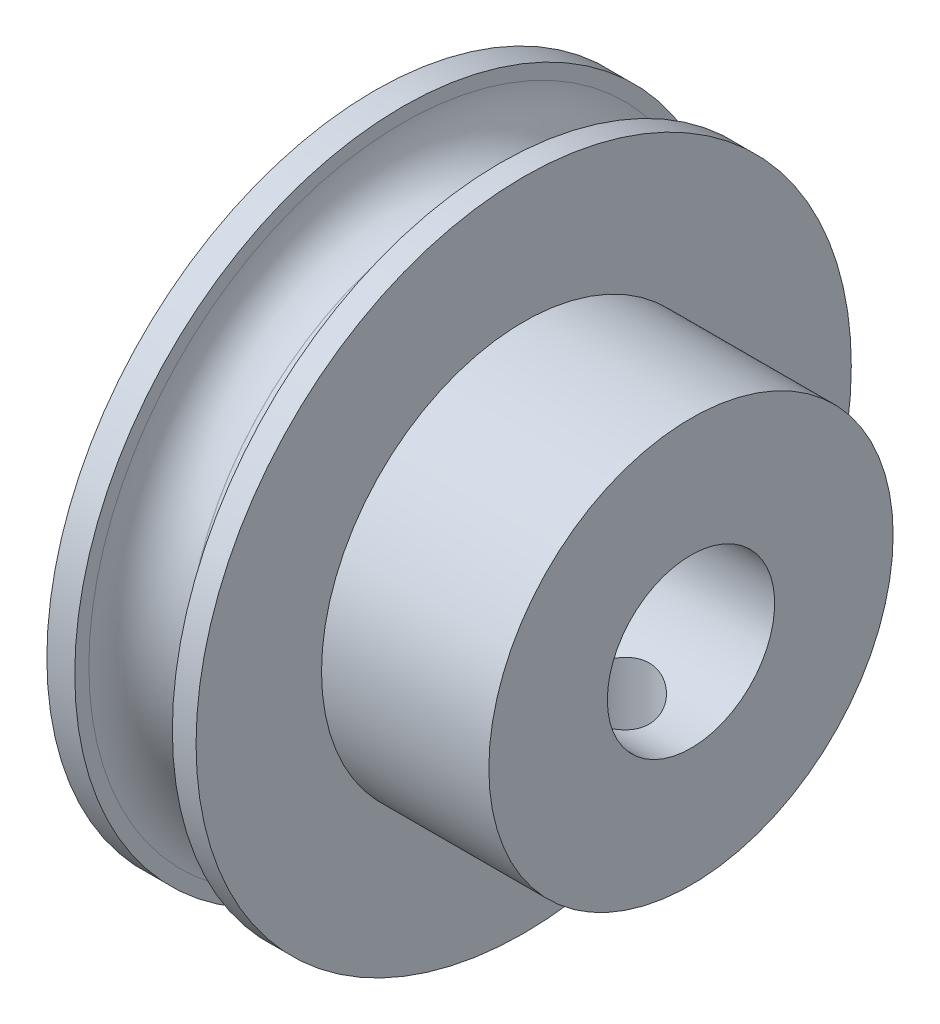
from build123d import *

# Parameters (mm, degrees)
CUT_EXTRUDE_1_REACH      = 42.247
CUT_EXTRUDE_1_END_RADIUS = 14.5
SKETCH_2_R               = 3


with BuildPart() as part:
    # Sketch 259 → Повернуть1 (revolve)
    with BuildSketch(Plane.XY, mode=Mode.PRIVATE) as revolve_1_sk:
        with BuildLine():
            Line((0, 6), (22.7, 6))
            Line((22.7, 6), (22.7, 14.5))
            Line((22.7, 14.5), (10.7, 14.5))
            Line((10.7, 14.5), (10.7, 23.5))
            Line((10.7, 23.5), (9, 23.5))
            Line((9, 23.5), (9, 22.49))
            ThreePointArc((9, 22.49), (7.977802666, 20.022197334), (5.51, 19))
            Line((5.51, 19), (5.49, 19))
            ThreePointArc((5.49, 19), (3.022197334, 20.022197334), (2, 22.49))
            Line((2, 22.49), (2, 23.5))
            Line((2, 23.5), (0, 23.5))
            Line((0, 23.5), (0, 6))
        make_face()
    revolve(revolve_1_sk.sketch.rotate(Axis((0, 0, 0), (1, 0, 0)), 90), axis=Axis((0, 0, 0), (1, 0, 0)))

    # Вырез-Вытянуть1: up to this cylinder (the profile starts inside it)
    cut_extrude_1_end = Plane(origin=(16.7, 0, 0), z_dir=(-1, 0, 0)) * Cylinder(CUT_EXTRUDE_1_END_RADIUS, 114.494, mode=Mode.PRIVATE)
    # Эскиз2 → Вырез-Вытянуть1 (cut, up to the surface)
    with BuildSketch(Plane(origin=(0, 0, 0), x_dir=(1, 0, 0), z_dir=(0, 1, 0)), mode=Mode.PRIVATE) as cut_extrude_1_sk1:
        with Locations(Location((16.7, 0, 0), (0, 0, 270))):
            Circle(SKETCH_2_R)
    cut_extrude_1_tool1 = extrude(cut_extrude_1_sk1.sketch, amount=-CUT_EXTRUDE_1_REACH, mode=Mode.PRIVATE) & cut_extrude_1_end
    add(cut_extrude_1_tool1.solids().sort_by_distance((16.7, 0, 0))[0], mode=Mode.SUBTRACT)


solid = part.part
